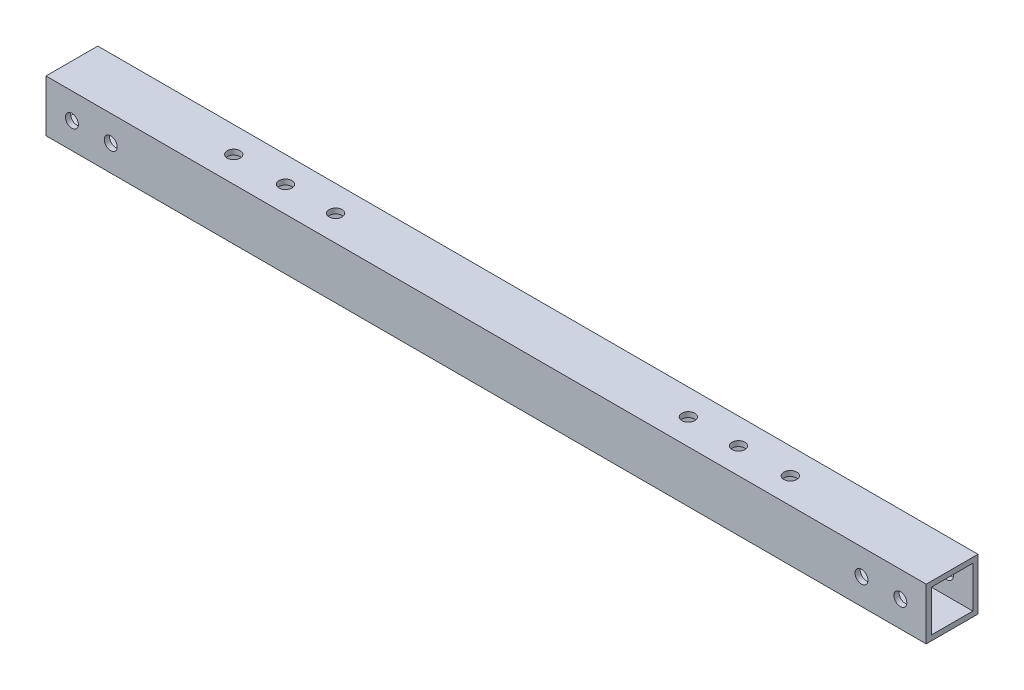
from build123d import *

# Parameters (mm, degrees)
SKETCH1_W           = 20
SKETCH1_H           = 20
SKETCH1_W_2         = 16
SKETCH1_H_2         = 16
BOSS_EXTRUDE1_DEPTH = 340
SKETCH2_R           = 2.5
CUT_EXTRUDE1_DEPTH  = 341.734500748
SKETCH3_R           = 2.5
CUT_EXTRUDE2_DEPTH  = 341.734500748
SKETCH4_R           = 2.5
CUT_EXTRUDE3_DEPTH  = 341.734500748


with BuildPart() as part:
    # Sketch1 → Boss-Extrude1 (new body)
    with BuildSketch(Plane(origin=(0, 0, 0), x_dir=(0, 0, -1), z_dir=(1, 0, 0))):
        Rectangle(SKETCH1_W, SKETCH1_H)
        Rectangle(SKETCH1_W_2, SKETCH1_H_2, mode=Mode.SUBTRACT)
    extrude(amount=BOSS_EXTRUDE1_DEPTH)

    # Sketch2 → Cut-Extrude1 (cut, through all)
    with BuildSketch(Plane.XY.offset(10)):
        with Locations((10, 0)):
            Circle(SKETCH2_R)
        with Locations((25, 0)):
            Circle(SKETCH2_R)
        with Locations(Location((315, 0, 0), (0, 0, 180))):
            Circle(SKETCH2_R)
        with Locations(Location((330, 0, 0), (0, 0, 180))):
            Circle(SKETCH2_R)
    extrude(amount=-CUT_EXTRUDE1_DEPTH, mode=Mode.SUBTRACT)

    # Sketch3 → Cut-Extrude2 (cut, through all)
    with BuildSketch(Plane(origin=(0, 10, 0), x_dir=(1, 0, 0), z_dir=(0, 1, 0))):
        with Locations(Location((62.5, 0, 0), (0, 0, 270))):
            Circle(SKETCH3_R)
        with Locations(Location((82.5, 0, 0), (0, 0, 270))):
            Circle(SKETCH3_R)
        with Locations(Location((257.5, 0, 0), (0, 0, 270))):
            Circle(SKETCH3_R)
        with Locations(Location((277.5, 0, 0), (0, 0, 270))):
            Circle(SKETCH3_R)
    extrude(amount=-CUT_EXTRUDE2_DEPTH, mode=Mode.SUBTRACT)

    # Sketch4 → Cut-Extrude3 (cut, through all)
    with BuildSketch(Plane(origin=(0, 10, 0), x_dir=(1, 0, 0), z_dir=(0, 1, 0))):
        with Locations(Location((101.88, 0, 0), (0, 0, 270))):
            Circle(SKETCH4_R)
        with Locations(Location((238.12, 0, 0), (0, 0, 270))):
            Circle(SKETCH4_R)
    extrude(amount=-CUT_EXTRUDE3_DEPTH, mode=Mode.SUBTRACT)


solid = part.part
